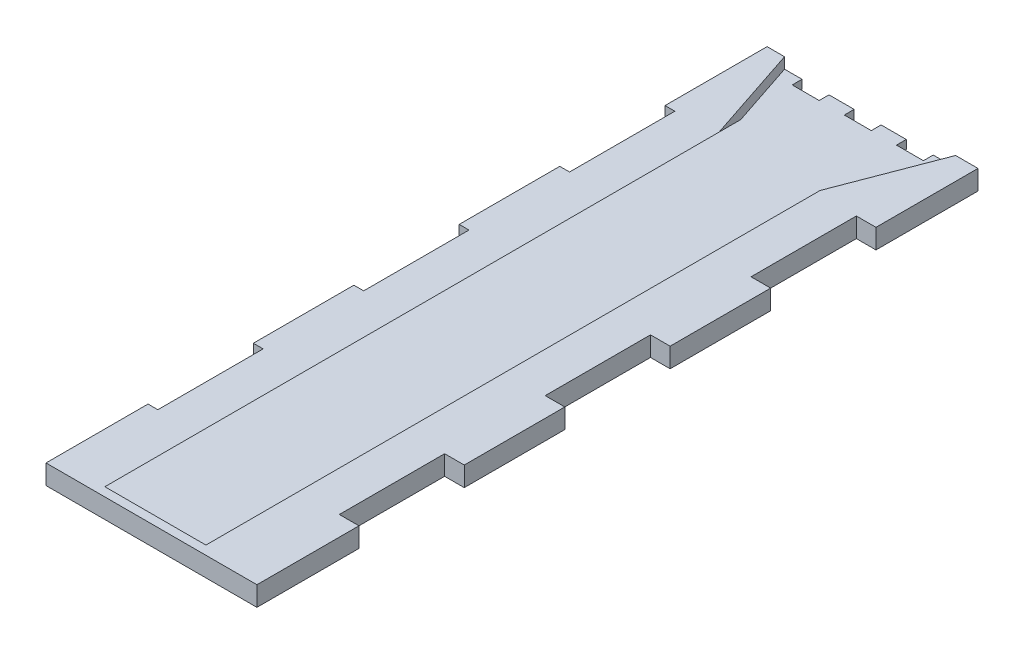
from build123d import *

# Parameters (mm, degrees)
SKETCH_4_W          = 37
SKETCH_4_H          = 145
EXTRUDE_1_DEPTH     = 4
SKETCH_5_W          = 5.125
SKETCH_5_H          = 4
EXTRUDE_2_DEPTH     = 2
SKETCH_7_W          = 20.8
SKETCH_7_H          = 4
SKETCH_7_W_2        = 20.5
EXTRUDE_3_DEPTH     = 4
EXTRUDE_START       = -37
SKETCH_7_2_W        = 20.8
SKETCH_7_2_H        = 4
SKETCH_7_2_W_2      = 20.5
EXTRUDE_4_DEPTH     = 2
CUT_EXTRUDE_START   = -1.8
CUT_EXTRUDE_1_DEPTH = 147.965755468
CUT_EXTRUDE_2_DEPTH = 78.854608085


with BuildPart() as part:
    # 草图4 → 凸台-拉伸1 (new body)
    with BuildSketch(Plane(origin=(0, 0, 0), x_dir=(1, 0, 0), z_dir=(0, 1, 0))):
        Rectangle(SKETCH_4_W, SKETCH_4_H)
    extrude(amount=EXTRUDE_1_DEPTH)

    # 草图5 → 凸台-拉伸2 (add)
    with BuildSketch(Plane(origin=(0, 0, -72.5), x_dir=(-1, 0, 0), z_dir=(0, 0, -1))):
        with Locations((-15.9375, 2)):
            Rectangle(SKETCH_5_W, SKETCH_5_H)
        with Locations((-5.3125, 2)):
            Rectangle(SKETCH_5_W, SKETCH_5_H)
        with Locations((5.3125, 2)):
            Rectangle(SKETCH_5_W, SKETCH_5_H)
        with Locations((15.9375, 2)):
            Rectangle(SKETCH_5_W, SKETCH_5_H)
    extrude(amount=EXTRUDE_2_DEPTH)

    # 草图7 → 凸台-拉伸3 (add)
    with BuildSketch(Plane(origin=(18.5, 0, 0), x_dir=(0, 0, -1), z_dir=(1, 0, 0))):
        with Locations((-62.1, 2)):
            Rectangle(SKETCH_7_W, SKETCH_7_H)
        with Locations((-19.983333333, 2)):
            Rectangle(SKETCH_7_W_2, SKETCH_7_H)
        with Locations((21.983333333, 2)):
            Rectangle(SKETCH_7_W_2, SKETCH_7_H)
        with Locations((64.1, 2)):
            Rectangle(SKETCH_7_W, SKETCH_7_H)
    extrude(amount=EXTRUDE_3_DEPTH)

    # 草图7<2> → 凸台-拉伸4 (add)
    with BuildSketch(Plane(origin=(18.5, 0, 0), x_dir=(0, 0, -1), z_dir=(1, 0, 0)).offset(EXTRUDE_START)):
        with Locations((-62.1, 2)):
            Rectangle(SKETCH_7_2_W, SKETCH_7_2_H)
        with Locations((-19.983333333, 2)):
            Rectangle(SKETCH_7_2_W_2, SKETCH_7_2_H)
        with Locations((21.983333333, 2)):
            Rectangle(SKETCH_7_2_W_2, SKETCH_7_2_H)
        with Locations((64.1, 2)):
            Rectangle(SKETCH_7_2_W, SKETCH_7_2_H)
    extrude(amount=-EXTRUDE_4_DEPTH)

    # 草图8 → 切除-拉伸1 (cut, through all)
    with BuildSketch(Plane.XY.offset(72.5).offset(CUT_EXTRUDE_START)):
        Polygon((10.3, 4), (-10.3, 4), (-12.5, 1.8), (-10.3, 1.8), (10.3, 1.8), (12.5, 1.8), align=None)
    extrude(amount=-CUT_EXTRUDE_1_DEPTH, mode=Mode.SUBTRACT)

    # 草图9 → 切除-拉伸2 (cut, through all)
    with BuildSketch(Plane(origin=(0, 1.8, 0), x_dir=(1, 0, 0), z_dir=(0, 1, 0))):
        Polygon((-16.9375, 74.5), (-10.3, 54.5), (10.3, 54.5), (17.9375, 74.5), align=None)
    extrude(amount=CUT_EXTRUDE_2_DEPTH, mode=Mode.SUBTRACT)


solid = part.part
